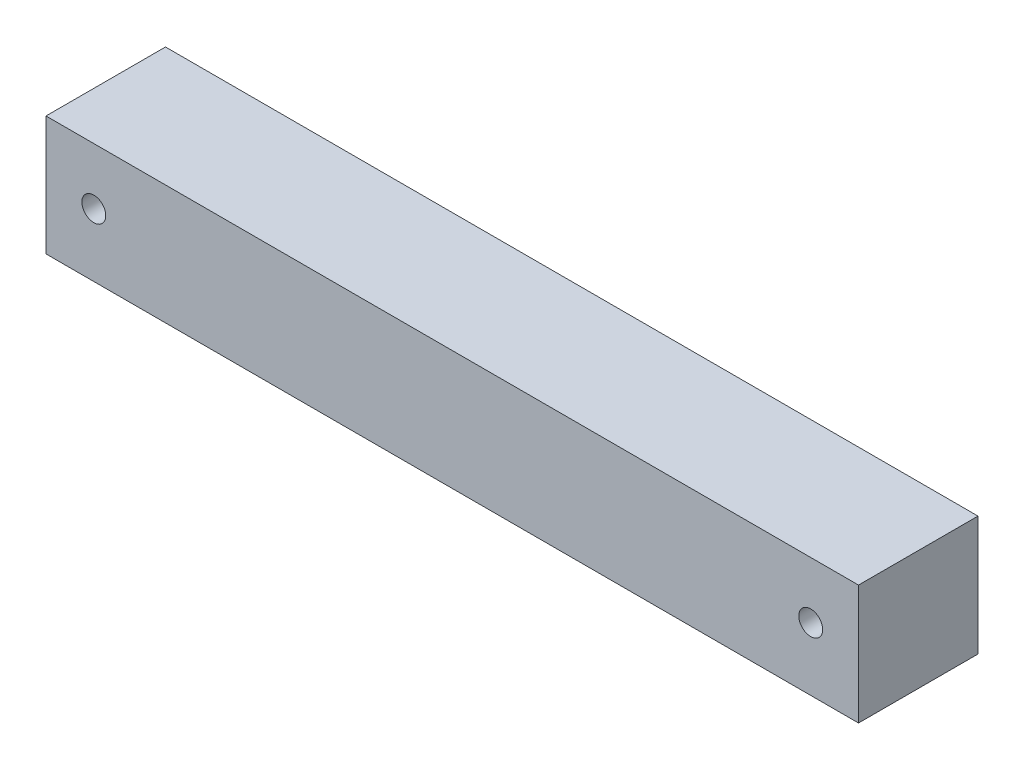
from build123d import *

# Parameters (mm, degrees)
ESQUISSE1_W        = 68
ESQUISSE1_H        = 10
ESQUISSE1_R        = 1
BOSS_EXTRU_1_DEPTH = 10


with BuildPart() as part:
    # Esquisse1 → Boss.-Extru.1 (new body)
    with BuildSketch(Plane.XY):
        with Locations((14.941925861, 16.285915493)):
            Rectangle(ESQUISSE1_W, ESQUISSE1_H)
        with Locations((44.941925861, 16.553552035)):
            Circle(ESQUISSE1_R, mode=Mode.SUBTRACT)
        with Locations((-15.058074139, 16.553552035)):
            Circle(ESQUISSE1_R, mode=Mode.SUBTRACT)
    extrude(amount=BOSS_EXTRU_1_DEPTH)


solid = part.part
